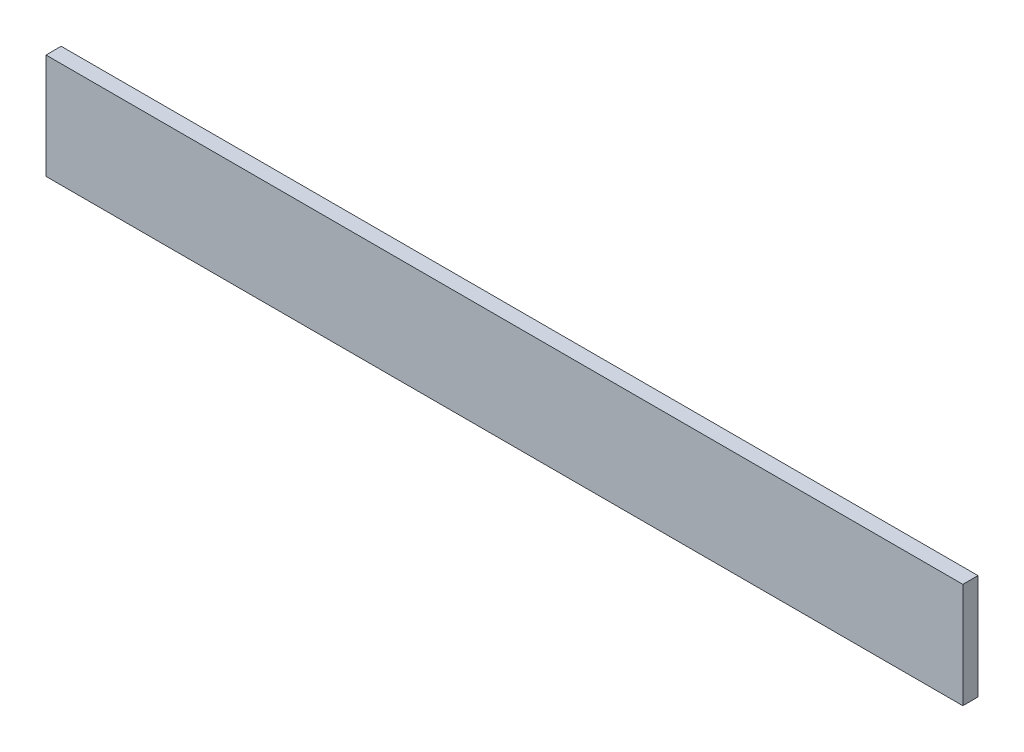
from build123d import *

# Parameters (mm, degrees)
SKETCH_1_W      = 302.260564469
SKETCH_1_H      = 34.66726103
EXTRUDE_1_DEPTH = 5


with BuildPart() as part:
    # Эскиз1 → Бобышка-Вытянуть1 (new body)
    with BuildSketch(Plane.XY):
        with Locations((80.662470251, 51.937141696)):
            Rectangle(SKETCH_1_W, SKETCH_1_H)
    extrude(amount=EXTRUDE_1_DEPTH)


solid = part.part
